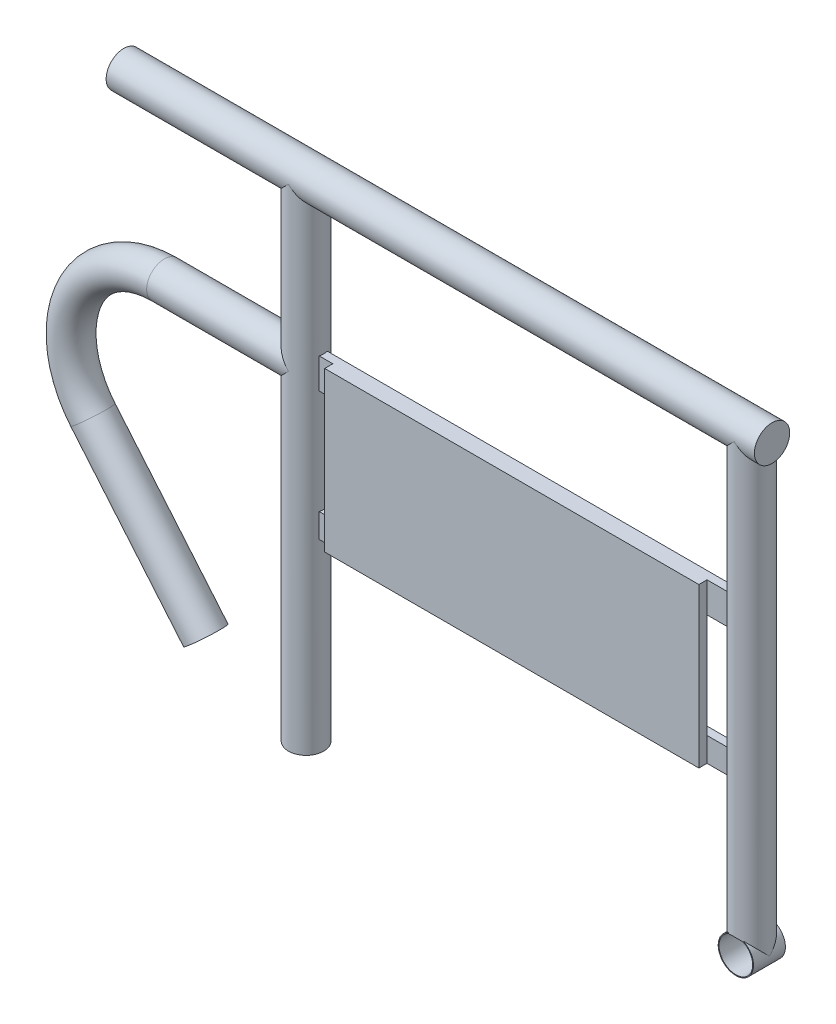
from build123d import *

# Parameters (mm, degrees)
SKETCH1_R            = 11.065
EXTRUDE1_DEPTH       = 279.4
EXTRUDE1_2_DEPTH     = 279.4
EXTRUDE2_DEPTH       = 292.1
EXTRUDE2_DEPTH_BACK  = 114.3
SKETCH2_R            = 11.065
SKETCH3_R            = 11.065
EXTRUDE3_DEPTH       = 114.3
EXTRUDE5_DEPTH       = 413.085865385
EXTRUDE5_DEPTH_BACK  = 413.085865385
SKETCH5_W            = 50.8
SKETCH5_H            = 22.13
SKETCH7_R            = 11.065
SKETCH7_R_2          = 1.065
SKETCH7_W            = 28.83710894
SKETCH7_H            = 10
REVOLVE_THIN3_ANGLE  = 130
SKETCH10_R           = 11.065
EXTRUDE6_DEPTH       = 110.1
SKETCH11_W           = 5.1
SKETCH11_H           = 19.05
SKETCH11_H_2         = 15.156574232
EXTRUDE7_DEPTH       = 279.4
SKETCH12_W           = 234.581497294
SKETCH12_H           = 99.653287116
EXTRUDE8_DEPTH       = 5.1
EXTRUDE9_DEPTH       = 10
EXTRUDE9_DEPTH_BACK  = 10
SKETCH13_R           = 11.065
SKETCH13_R_2         = 10.565
EXTRUDE10_DEPTH      = 413.475527097
EXTRUDE10_DEPTH_BACK = 413.475527097
SKETCH14_R           = 10.565
SKETCH15_R           = 11.065
EXTRUDE11_DEPTH      = 28.4


with BuildPart() as part:
    # Sketch1 → Extrude1 (new body)
    with BuildSketch(Plane(origin=(0, 0, 0), x_dir=(1, 0, 0), z_dir=(0, 1, 0))):
        with Locations(Location((0, 0, 0), (0, 0, 270))):
            Circle(SKETCH1_R)
    extrude(amount=EXTRUDE1_DEPTH)



with BuildPart() as body_2:
    # Sketch1 → Extrude1 2 (new body)
    with BuildSketch(Plane(origin=(0, 0, 0), x_dir=(1, 0, 0), z_dir=(0, 1, 0))):
        with Locations(Location((279.4, 0, 0), (0, 0, 270))):
            Circle(SKETCH1_R)
    extrude(amount=EXTRUDE1_2_DEPTH)


with BuildPart() as part_1:
    add(part.part)

    add(body_2.part)  # Extrude2 merges body 2
    # Sketch2 → Extrude2 (add, two sides: drawn at the far end of the back side and taken through both)
    with BuildSketch(Plane(origin=(0, 0, 0), x_dir=(0, 0, -1), z_dir=(1, 0, 0)).offset(-EXTRUDE2_DEPTH_BACK)):
        with Locations((0, 279.4)):
            Circle(SKETCH2_R)
    extrude(amount=EXTRUDE2_DEPTH + EXTRUDE2_DEPTH_BACK)

    # Sketch3 → Extrude3 (add)
    with BuildSketch(Plane.ZY.offset(114.3)):
        with Locations((0, 177.8)):
            Circle(SKETCH3_R)
    extrude(amount=-EXTRUDE3_DEPTH)

    # Sketch5 → Extrude5 (cut, two sides: drawn at the far end of the back side and taken through both)
    with BuildSketch(Plane.XY.offset(-EXTRUDE5_DEPTH_BACK)):
        with Locations((-114.3, 177.8)):
            Rectangle(SKETCH5_W, SKETCH5_H)
    extrude(amount=EXTRUDE5_DEPTH + EXTRUDE5_DEPTH_BACK, mode=Mode.SUBTRACT)

    # Sketch7 → Revolve-Thin3 (revolve)
    # profile 1 of 2: a face of its own
    with BuildSketch(Plane.ZY.offset(88.9)):
        with Locations((0, 177.8)):
            Circle(SKETCH7_R)
        with Locations((0, 177.8)):
            Circle(SKETCH7_R_2, mode=Mode.SUBTRACT)
    # profile 2 of 2: a face of its own
    with BuildSketch(Plane.ZY.offset(88.9)):
        with Locations((14.41855447, 124.38)):
            Rectangle(SKETCH7_W, SKETCH7_H)
    revolve(axis=Axis((-88.9, 119.38, 0), (0, 0, 1)), revolution_arc=REVOLVE_THIN3_ANGLE)


with BuildPart() as revolve_thin3_kept_piece:
    # of the separate pieces the step leaves, the one the design keeps (revolve_thin3_pieces_kept)
    add(part_1.part.solids().sort_by_distance((0, 0, 11.065))[0])

    # Sketch10 → Extrude6 (add)
    with BuildSketch(Plane(origin=(-95.51451328, 113.829764346, 0), x_dir=(0.7660444431189746, 0.6427876096865435, 0), z_dir=(0.6427876096865435, -0.7660444431189746, 0))):
        with Locations(Location((-49.785366149, 0, 0), (0, 0, 180))):
            Circle(SKETCH10_R)
    extrude(amount=EXTRUDE6_DEPTH)

    # Sketch11 → Extrude7 (add)
    with BuildSketch(Plane(origin=(0, 0, 0), x_dir=(0, 0, -1), z_dir=(1, 0, 0))):
        with Locations((0, 177.8)):
            Rectangle(SKETCH11_W, SKETCH11_H)
        with Locations((0, 95.25)):
            Rectangle(SKETCH11_W, SKETCH11_H_2)
    extrude(amount=EXTRUDE7_DEPTH)

    # Sketch12 → Extrude8 (add)
    with BuildSketch(Plane.XY.offset(2.55)):
        with Locations((136.583327193, 137.498356442)):
            Rectangle(SKETCH12_W, SKETCH12_H)
    extrude(amount=EXTRUDE8_DEPTH)


with BuildPart() as extrude9_tool:
    # Sketch13 → Extrude9 (new, two sides: drawn at the far end of the back side and taken through both)
    with BuildSketch(Plane.XY.offset(-EXTRUDE9_DEPTH_BACK)):
        with Locations((279.4, 0)):
            Circle(SKETCH13_R)
        with Locations((279.4, 0)):
            Circle(SKETCH13_R_2, mode=Mode.SUBTRACT)
    extrude(amount=EXTRUDE9_DEPTH + EXTRUDE9_DEPTH_BACK)


with BuildPart() as revolve_thin3_kept_piece_1:
    add(revolve_thin3_kept_piece.part)


with BuildPart() as revolve_thin3_kept_piece_2:
    # Extrude9: joined with extrude9_tool
    add(revolve_thin3_kept_piece_1.part.fuse(extrude9_tool.part, tol=0.00001))

    # Sketch14 → Extrude10 (cut, two sides: drawn at the far end of the back side and taken through both)
    with BuildSketch(Plane(origin=(0, 0, -10), x_dir=(-1, 0, 0), z_dir=(0, 0, -1)).offset(-EXTRUDE10_DEPTH_BACK)):
        with Locations(Location((-279.4, 0, 0), (0, 0, 116.635810294))):
            Circle(SKETCH14_R)
    extrude(amount=EXTRUDE10_DEPTH + EXTRUDE10_DEPTH_BACK, mode=Mode.SUBTRACT)

    # Sketch15 → Extrude11 (add)
    with BuildSketch(Plane.XZ):
        with Locations(Location((0, 0, 0), (0, 0, 270))):
            Circle(SKETCH15_R)
    extrude(amount=EXTRUDE11_DEPTH)


solid = revolve_thin3_kept_piece_2.part
